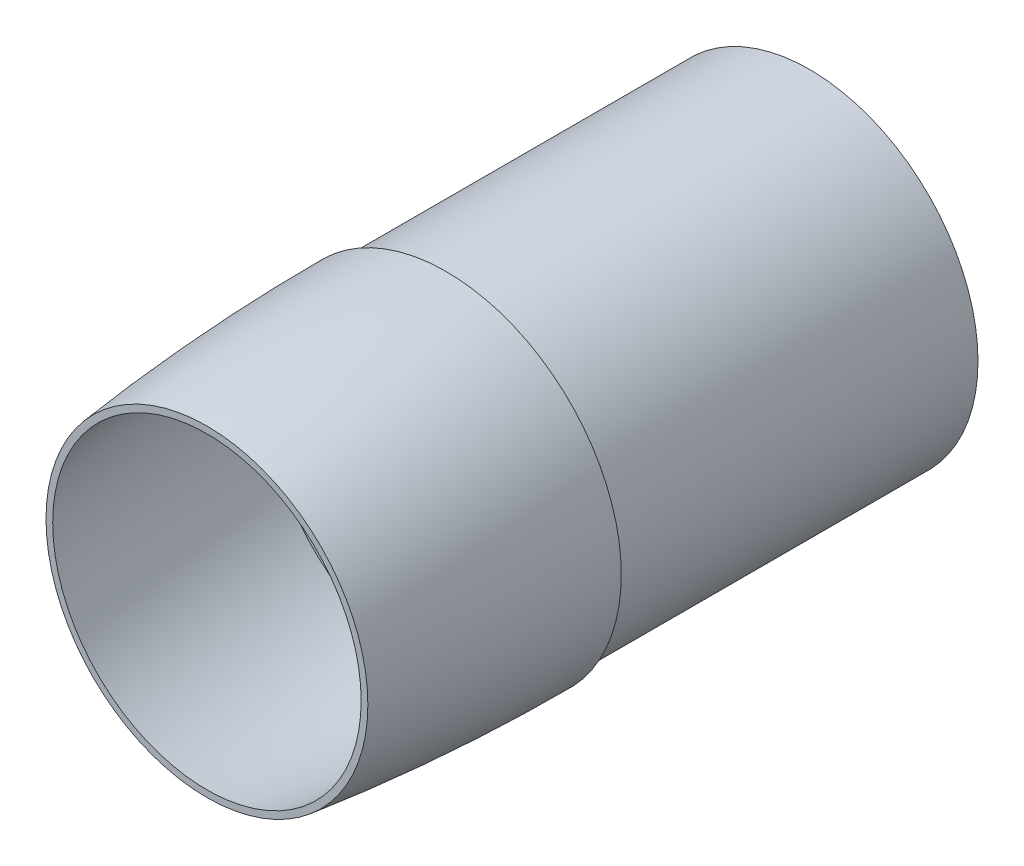
from build123d import *


with BuildPart() as part:
    # Sketch1 → Revolve1 (revolve)
    with BuildSketch(Plane(origin=(0, 0, 0), x_dir=(0, 0, -1), z_dir=(1, 0, 0)), mode=Mode.PRIVATE) as revolve1_sk:
        with BuildLine():
            Line((0, 459.243902439), (0, 457.743902439))
            Line((0, 457.743902439), (82, 457.743902439))
            Line((82, 457.743902439), (82, 419.743902439))
            Line((82, 419.743902439), (79, 419.743902439))
            Line((79, 419.743902439), (79, 454.743902439))
            Line((79, 454.743902439), (-3, 454.743902439))
            Line((-3, 454.743902439), (-3, 457.734071509))
            ThreePointArc((-3, 457.734071509), (-28.544499839, 456.853030798), (-54, 454.54755551))
            Line((-54, 454.54755551), (-54, 456.058068592))
            ThreePointArc((-54, 456.058068592), (-27.046947782, 458.446752135), (0, 459.243902439))
        make_face()
    revolve(revolve1_sk.sketch.rotate(Axis((0, 419.743902439, 182.604864627), (0, 0, -1)), 90), axis=Axis((0, 419.743902439, 182.604864627), (0, 0, -1)))


solid = part.part
